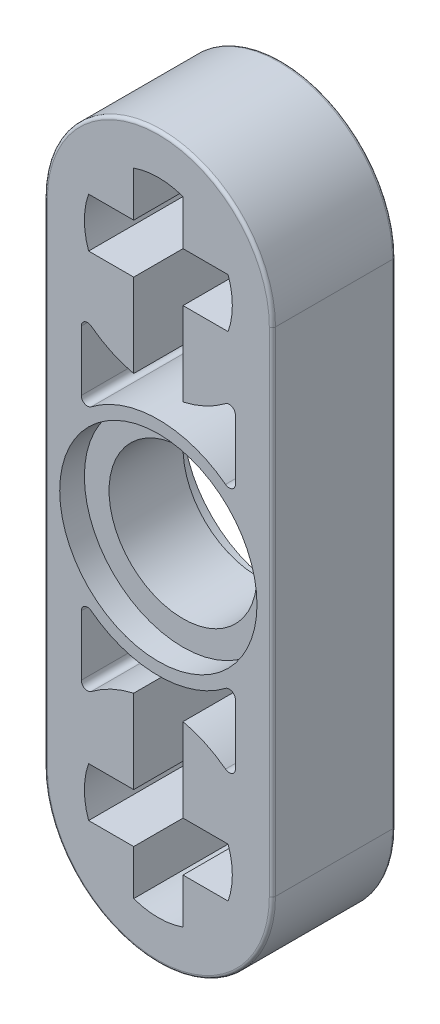
from build123d import *

# Parameters (mm, degrees)
BOSS_EXTRUDE1_DEPTH = 4
CUT_EXTRUDE1_DEPTH  = 21.439667316
CUT_EXTRUDE2_DEPTH  = 21.439667316
FILLET1_R           = 0.1


with BuildPart() as part:
    # Sketch1 → Boss-Extrude1 (new body)
    with BuildSketch(Plane(origin=(0, 0, -2), x_dir=(-1, 0, 0), z_dir=(0, 0, -1))):
        with BuildLine():
            Line((-3.7, 0), (-3.7, -16))
            ThreePointArc((-3.7, -16), (0, -19.7), (3.7, -16))
            Line((3.7, -16), (3.7, 0))
            ThreePointArc((3.7, 0), (0, 3.7), (-3.7, 0))
        make_face()
    extrude(amount=-BOSS_EXTRUDE1_DEPTH)

    # Sketch2 → Cut-Extrude1 (cut, through all)
    with BuildSketch(Plane(origin=(0, 0, -2), x_dir=(-1, 0, 0), z_dir=(0, 0, -1))):
        with BuildLine():
            Line((-0.8, -0.8), (-0.8, -3.509985755))
            ThreePointArc((-0.8, -3.509985755), (-1.523912922, -3.261547088), (-2.178947368, -2.865691603))
            ThreePointArc((-2.178947368, -2.865691603), (-2.388852332, -2.845717276), (-2.5, -3.024896692))
            Line((-2.5, -3.024896692), (-2.5, -4.975103308))
            ThreePointArc((-2.5, -4.975103308), (-2.388852332, -5.154282724), (-2.178947368, -5.134308397))
            ThreePointArc((-2.178947368, -5.134308397), (0, -4.4), (2.178947368, -5.134308397))
            ThreePointArc((2.178947368, -5.134308397), (2.388852332, -5.154282724), (2.5, -4.975103308))
            Line((2.5, -4.975103308), (2.5, -3.024896692))
            ThreePointArc((2.5, -3.024896692), (2.388852332, -2.845717276), (2.178947368, -2.865691603))
            ThreePointArc((2.178947368, -2.865691603), (1.523912922, -3.261547088), (0.8, -3.509985755))
            Line((0.8, -3.509985755), (0.8, -0.8))
            Line((0.8, -0.8), (2.2627417, -0.8))
            ThreePointArc((2.2627417, -0.8), (2.4, 0), (2.2627417, 0.8))
            Line((2.2627417, 0.8), (0.8, 0.8))
            Line((0.8, 0.8), (0.8, 2.2627417))
            ThreePointArc((0.8, 2.2627417), (0, 2.4), (-0.8, 2.2627417))
            Line((-0.8, 2.2627417), (-0.8, 0.8))
            Line((-0.8, 0.8), (-2.2627417, 0.8))
            ThreePointArc((-2.2627417, 0.8), (-2.4, 0), (-2.2627417, -0.8))
            Line((-2.2627417, -0.8), (-0.8, -0.8))
        make_face()
    extrude(amount=-CUT_EXTRUDE1_DEPTH, mode=Mode.SUBTRACT)

    # Sketch3 → Cut-Extrude2 (cut, through all)
    with BuildSketch(Plane.XY.offset(2)):
        with BuildLine():
            Line((2.5, -12.975103308), (2.5, -11.024896692))
            ThreePointArc((2.5, -11.024896692), (2.388852332, -10.845717276), (2.178947368, -10.865691603))
            ThreePointArc((2.178947368, -10.865691603), (0, -11.6), (-2.178947368, -10.865691603))
            ThreePointArc((-2.178947368, -10.865691603), (-2.388852332, -10.845717276), (-2.5, -11.024896692))
            Line((-2.5, -11.024896692), (-2.5, -12.975103308))
            ThreePointArc((-2.5, -12.975103308), (-2.388852332, -13.154282724), (-2.178947368, -13.134308397))
            ThreePointArc((-2.178947368, -13.134308397), (-1.523912922, -12.738452912), (-0.8, -12.490014245))
            Line((-0.8, -12.490014245), (-0.8, -15.2))
            Line((-0.8, -15.2), (-2.2627417, -15.2))
            ThreePointArc((-2.2627417, -15.2), (-2.4, -16), (-2.2627417, -16.8))
            Line((-2.2627417, -16.8), (-0.8, -16.8))
            Line((-0.8, -16.8), (-0.8, -18.2627417))
            ThreePointArc((-0.8, -18.2627417), (0, -18.4), (0.8, -18.2627417))
            Line((0.8, -18.2627417), (0.8, -16.8))
            Line((0.8, -16.8), (2.2627417, -16.8))
            ThreePointArc((2.2627417, -16.8), (2.4, -16), (2.2627417, -15.2))
            Line((2.2627417, -15.2), (0.8, -15.2))
            Line((0.8, -15.2), (0.8, -12.490014245))
            ThreePointArc((0.8, -12.490014245), (1.523912922, -12.738452912), (2.178947368, -13.134308397))
            ThreePointArc((2.178947368, -13.134308397), (2.388852332, -13.154282724), (2.5, -12.975103308))
        make_face()
    extrude(amount=-CUT_EXTRUDE2_DEPTH, mode=Mode.SUBTRACT)

    # Sketch4 → Cut-Revolve1 (revolve, cut)
    with BuildSketch(Plane(origin=(0, -8, 0), x_dir=(1, 0, 0), z_dir=(0, 1, 0))):
        Polygon((3.2, 2), (0, 2), (0, -2), (3.2, -2), (3.2, -1.2), (2.4, -1.2), (2.4, 1.2), (3.2, 1.2), align=None)
    revolve(axis=Axis((0, -8, -2), (0, 0, 1)), mode=Mode.SUBTRACT)

    # Fillet1
    fillet1_edges = [part.edges().sort_by_distance(p)[0] for p in [
        (0, -19.7, 2),
        (-3.7, -8, 2),
        (0, 3.7, 2),
        (-3.7, -8, -2),
        (0, -19.7, -2),
        (3.7, -8, -2),
        (0, 3.7, -2),
        (3.7, -8, 2),
    ]]
    fillet(fillet1_edges, radius=FILLET1_R)


solid = part.part
